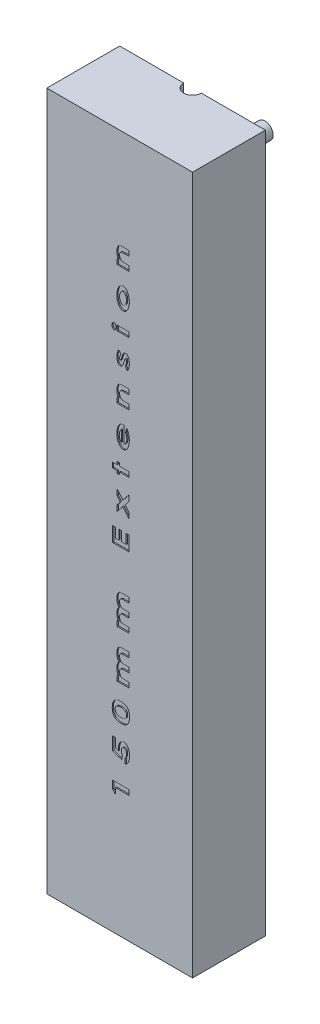
from build123d import *

# Parameters (mm, degrees)
SKETCH1_R            = 12.5
BOSS_EXTRUDE1_DEPTH  = 150.5
BOSS_EXTRUDE2_DEPTH  = 148.5
SKETCH8_R            = 12.5
CUT_EXTRUDE2_DEPTH   = 152.706130397
BOSS_EXTRUDE7_DEPTH  = 8
BOSS_EXTRUDE8_START  = -121
BOSS_EXTRUDE8_DEPTH  = 121
BOSS_EXTRUDE9_DEPTH  = 148.5
SKETCH13_R           = 1.75
CUT_EXTRUDE3_DEPTH   = 3.5
SKETCH14_R           = 1.75
BOSS_EXTRUDE10_DEPTH = 3.4
SKETCH15_R           = 1.75
CUT_EXTRUDE4_DEPTH   = 3.5
SKETCH16_R           = 1.75
BOSS_EXTRUDE11_DEPTH = 3.4
SKETCH18_W           = 2.557692308
SKETCH18_H           = 1.076923077
CUT_EXTRUDE6_DEPTH   = 0.25


with BuildPart() as part:
    # Sketch1 → Boss-Extrude1 (new body)
    with BuildSketch(Plane(origin=(0, 0, 0), x_dir=(1, 0, 0), z_dir=(0, 1, 0))):
        with Locations(Location((0, 0, 0), (0, 0, 270))):
            Circle(SKETCH1_R)
    extrude(amount=BOSS_EXTRUDE1_DEPTH)

    # Sketch2 → Boss-Extrude2 (add)
    with BuildSketch(Plane(origin=(0, 150.5, 0), x_dir=(1, 0, 0), z_dir=(0, 1, 0))):
        with BuildLine():
            Line((-13.5, 0), (13.5, 0))
            ThreePointArc((13.5, 0), (0, -13.5), (-13.5, 0))
        make_face()
    extrude(amount=-BOSS_EXTRUDE2_DEPTH)

    # Sketch8 → Cut-Extrude2 (cut, through all)
    with BuildSketch(Plane(origin=(0, 150.5, 0), x_dir=(1, 0, 0), z_dir=(0, 1, 0))):
        Circle(SKETCH8_R)
    extrude(amount=-CUT_EXTRUDE2_DEPTH, mode=Mode.SUBTRACT)

    # Sketch9 → Boss-Extrude7 (add)
    with BuildSketch(Plane(origin=(0, 150.5, 0), x_dir=(1, 0, 0), z_dir=(0, 1, 0))):
        with BuildLine():
            Line((12.5, 0), (1.875, 0))
            ThreePointArc((1.875, 0), (0, -1.875), (-1.875, 0))
            Line((-1.875, 0), (-12.5, 0))
            ThreePointArc((-12.5, 0), (0, -12.5), (12.5, 0))
        make_face()
    extrude(amount=-BOSS_EXTRUDE7_DEPTH)

    # Sketch11 → Boss-Extrude8 (add)
    with BuildSketch(Plane.XZ.offset(-2).offset(BOSS_EXTRUDE8_START)):
        with BuildLine():
            Line((-12.5, 0), (-8, 0))
            ThreePointArc((-8, 0), (0, 8), (8, 0))
            Line((8, 0), (12.5, 0))
            ThreePointArc((12.5, 0), (0, 12.5), (-12.5, 0))
        make_face()
    extrude(amount=BOSS_EXTRUDE8_DEPTH)

    # Sketch12 → Boss-Extrude9 (add)
    with BuildSketch(Plane(origin=(0, 150.5, 0), x_dir=(1, 0, 0), z_dir=(0, 1, 0))):
        with BuildLine():
            Line((-13.5, 0), (-15.5, 0))
            Line((-15.5, 0), (-15.5, -15.5))
            Line((-15.5, -15.5), (15.5, -15.5))
            Line((15.5, -15.5), (15.5, 0))
            Line((15.5, 0), (13.5, 0))
            ThreePointArc((13.5, 0), (0, -13.5), (-13.5, 0))
        make_face()
    extrude(amount=-BOSS_EXTRUDE9_DEPTH)

    # Sketch13 → Cut-Extrude3 (cut)
    with BuildSketch(Plane(origin=(0, 0, 0), x_dir=(-1, 0, 0), z_dir=(0, 0, -1))):
        with Locations((12, 147)):
            Circle(SKETCH13_R)
    extrude(amount=-CUT_EXTRUDE3_DEPTH, mode=Mode.SUBTRACT)

    # Sketch14 → Boss-Extrude10 (add)
    with BuildSketch(Plane(origin=(0, 0, 0), x_dir=(-1, 0, 0), z_dir=(0, 0, -1))):
        with Locations((-12, 147)):
            Circle(SKETCH14_R)
    extrude(amount=BOSS_EXTRUDE10_DEPTH)

    # Sketch15 → Cut-Extrude4 (cut)
    with BuildSketch(Plane(origin=(0, 0, 0), x_dir=(-1, 0, 0), z_dir=(0, 0, -1))):
        with Locations((-12, 5.5)):
            Circle(SKETCH15_R)
    extrude(amount=-CUT_EXTRUDE4_DEPTH, mode=Mode.SUBTRACT)

    # Sketch16 → Boss-Extrude11 (add)
    with BuildSketch(Plane(origin=(0, 0, 0), x_dir=(-1, 0, 0), z_dir=(0, 0, -1))):
        with Locations((12, 5.5)):
            Circle(SKETCH16_R)
    extrude(amount=BOSS_EXTRUDE11_DEPTH)

    # Sketch18 → Cut-Extrude6 (cut)
    # profile 1 of 15: a face of its own
    with BuildSketch(Plane.XY.offset(15.5)):
        Polygon((-1.5, 28.311097756), (-1.5, 29.961538462), (2, 29.961538462), (2, 28.884615385), (-0.916666667, 28.884615385), (-0.916666667, 27.673076923), align=None)
    # profile 2 of 15: a face of its own
    with BuildSketch(Plane.XY.offset(15.5)):
        with BuildLine():
            Line((-1.5, 35.391726763), (-1.5, 38.128205128))
            Line((-1.5, 38.128205128), (-0.916666667, 38.128205128))
            Line((-0.916666667, 38.128205128), (-0.916666667, 36.214142628))
            Line((-0.916666667, 36.214142628), (-0.254807692, 35.975060096))
            add(Edge.make_bspline(
                [(-0.254807692, 35.975060096), (-0.259988923, 36.007507661), (-0.270176439, 36.071307195), (-0.280551947, 36.166292562), (-0.287159319, 36.25821841), (-0.288034547, 36.318599273), (-0.288461538, 36.348056891)],
                knots=[0, 0, 0, 0, 1.051536562, 2.067567929, 3.057236978, 4, 4, 4, 4], degree=3))
            add(Edge.make_bspline(
                [(-0.288461538, 36.348056891), (-0.287628341, 36.412126937), (-0.285995892, 36.537656591), (-0.270002992, 36.721648009), (-0.245179891, 36.897583066), (-0.209710122, 37.06520123), (-0.163136425, 37.224433976), (-0.106976739, 37.375589484), (-0.041504138, 37.519053835), (0.034844766, 37.652181041), (0.117829482, 37.774010883), (0.208297834, 37.880323614), (0.304528331, 37.97070793), (0.406395394, 38.045161218), (0.51486959, 38.102546972), (0.628757484, 38.143746307), (0.748641691, 38.16805188), (0.830419369, 38.171385959), (0.871895032, 38.173076923)],
                knots=[0, 0, 0, 0, 1.285126278, 2.517892021, 3.702160817, 4.847992253, 5.95190268, 7.027499764, 8.080655882, 9.111767517, 10.10280642, 11.033985104, 11.906450985, 12.745848305, 13.557550898, 14.359923657, 15.168192882, 16, 16, 16, 16], degree=3))
            add(Edge.make_bspline(
                [(0.871895032, 38.173076923), (0.913859014, 38.171268779), (0.997238157, 38.167676138), (1.11977112, 38.140483598), (1.236597108, 38.093932522), (1.348228978, 38.03022381), (1.454546489, 37.948118847), (1.55531246, 37.847941912), (1.650978481, 37.729673312), (1.739996246, 37.595196589), (1.822169011, 37.448643207), (1.893711511, 37.292104711), (1.954879936, 37.128212618), (2.003798241, 36.955989434), (2.042165462, 36.776313293), (2.070412639, 36.588820716), (2.086411006, 36.393443884), (2.08861956, 36.260678866), (2.08974359, 36.193108974)],
                knots=[0, 0, 0, 0, 0.78802525, 1.565744404, 2.344417368, 3.142820932, 3.972730725, 4.860717351, 5.806374154, 6.825666734, 7.887162955, 8.959887664, 10.056052622, 11.170627005, 12.320323857, 13.505753456, 14.730569455, 16, 16, 16, 16], degree=3))
            add(Edge.make_bspline(
                [(2.08974359, 36.193108974), (2.08880553, 36.132567093), (2.086960399, 36.013483251), (2.076282175, 35.837874379), (2.055360568, 35.66907225), (2.028604614, 35.506234602), (1.992577042, 35.350497514), (1.950239072, 35.200517404), (1.897951782, 35.058015388), (1.839719876, 34.922081471), (1.774015187, 34.79559537), (1.702663224, 34.679145534), (1.624801508, 34.574650855), (1.541456228, 34.480832519), (1.452123238, 34.398769423), (1.35613166, 34.328824024), (1.255371563, 34.268835815), (1.183371336, 34.239166821), (1.147435897, 34.224358974)],
                knots=[0, 0, 0, 0, 1.25655317, 2.471597798, 3.648941709, 4.785206545, 5.894738896, 6.964712259, 8.017251193, 9.042618574, 10.031844767, 10.972706793, 11.873888934, 12.732644413, 13.573754768, 14.385734448, 15.194317255, 16, 16, 16, 16], degree=3))
            Line((1.147435897, 34.224358974), (1.147435897, 35.391025641))
            add(Edge.make_bspline(
                [(1.147435897, 35.391025641), (1.172455313, 35.414431965), (1.222705783, 35.461442606), (1.286069954, 35.54529255), (1.340146471, 35.638805434), (1.383870261, 35.742455062), (1.418771308, 35.853754398), (1.443871827, 35.971569802), (1.458825264, 36.095032096), (1.460622596, 36.179044706), (1.461538462, 36.221854968)],
                knots=[0, 0, 0, 0, 0.896977403, 1.801542313, 2.743307529, 3.723371397, 4.744769447, 5.797650386, 6.877749863, 8, 8, 8, 8], degree=3))
            add(Edge.make_bspline(
                [(1.461538462, 36.221854968), (1.460894158, 36.251780146), (1.459633994, 36.31030945), (1.452850282, 36.396551104), (1.440110656, 36.479193287), (1.422677594, 36.558629524), (1.400235046, 36.634565624), (1.372880352, 36.707012967), (1.340537075, 36.775934761), (1.303744891, 36.840801968), (1.262867246, 36.900117873), (1.218537302, 36.952074226), (1.172310553, 36.997275431), (1.121918766, 37.033082672), (1.06911192, 37.061757035), (1.012958847, 37.081285297), (0.954234659, 37.093698497), (0.914025038, 37.095327552), (0.893629808, 37.096153846)],
                knots=[0, 0, 0, 0, 1.246571979, 2.438113878, 3.600023611, 4.726573901, 5.823031953, 6.895108602, 7.948911145, 8.990868262, 9.998052814, 10.944064317, 11.832216848, 12.683156875, 13.510554676, 14.326420236, 15.151122455, 16, 16, 16, 16], degree=3))
            add(Edge.make_bspline(
                [(0.893629808, 37.096153846), (0.87370782, 37.095573147), (0.834697398, 37.094436045), (0.777570008, 37.082671228), (0.723436998, 37.063605141), (0.671597236, 37.03751713), (0.623087343, 37.003378845), (0.577117743, 36.962093378), (0.53345559, 36.913730146), (0.494324211, 36.857579015), (0.458068809, 36.797210875), (0.42632299, 36.733003537), (0.399568747, 36.665469204), (0.378254924, 36.59450884), (0.360170472, 36.520918723), (0.348914867, 36.443901941), (0.340497558, 36.364135358), (0.339997428, 36.309752896), (0.33974359, 36.282151442)],
                knots=[0, 0, 0, 0, 0.876153622, 1.715648235, 2.555268965, 3.397408059, 4.262310933, 5.158714413, 6.113238066, 7.124008222, 8.166949607, 9.211564772, 10.273969169, 11.361101136, 12.471743462, 13.606902068, 14.785399164, 16, 16, 16, 16], degree=3))
            add(Edge.make_bspline(
                [(0.33974359, 36.282151442), (0.340408317, 36.252204017), (0.341741811, 36.192127214), (0.352859403, 36.102659143), (0.369393197, 36.013452585), (0.394098811, 35.925358361), (0.426035764, 35.837838671), (0.464477566, 35.751066401), (0.510176943, 35.665060386), (0.54548698, 35.609778104), (0.563401442, 35.581730769)],
                knots=[0, 0, 0, 0, 0.962989015, 1.931828919, 2.896078871, 3.879163779, 4.870834245, 5.890601325, 6.929801607, 8, 8, 8, 8], degree=3))
            Line((0.563401442, 35.581730769), (0.442107372, 34.684995994))
            Line((0.442107372, 34.684995994), (-1.5, 35.391726763))
        make_face()
    # profile 3 of 15: a face of its own
    with BuildSketch(Plane.XY.offset(15.5)):
        with BuildLine():
            add(Edge.make_bspline(
                [(-1.58974359, 43.315805288), (-1.589293826, 43.36746958), (-1.588411874, 43.468779149), (-1.578854729, 43.618000446), (-1.564241333, 43.761849542), (-1.544364743, 43.900480474), (-1.517389179, 44.033531721), (-1.485322223, 44.161116185), (-1.447615042, 44.283453263), (-1.403466032, 44.400130996), (-1.352872335, 44.510773485), (-1.29725042, 44.615894433), (-1.233543204, 44.713312149), (-1.16485813, 44.805030734), (-1.089547652, 44.890095442), (-1.008228867, 44.968658733), (-0.920626453, 45.040748038), (-0.826335398, 45.106270558), (-0.724060924, 45.164945377), (-0.612533529, 45.215522045), (-0.491621845, 45.257963332), (-0.361398036, 45.293281937), (-0.221318141, 45.31916846), (-0.072064366, 45.339070811), (0.086713197, 45.349891068), (0.195531413, 45.351657275), (0.251402244, 45.352564103)],
                knots=[0, 0, 0, 0, 1.180076718, 2.314036622, 3.414226188, 4.482594488, 5.511827987, 6.514051976, 7.486717573, 8.434643478, 9.361635716, 10.264531142, 11.148604878, 12.017770531, 12.880121158, 13.74098312, 14.598195235, 15.469015398, 16.361001076, 17.287993313, 18.262313192, 19.285435953, 20.367061594, 21.514017738, 22.723615396, 24, 24, 24, 24], degree=3))
            add(Edge.make_bspline(
                [(0.251402244, 45.352564103), (0.307971012, 45.351637403), (0.417950632, 45.349835737), (0.578203527, 45.339340575), (0.728550996, 45.318319772), (0.869654662, 45.292089357), (1.000566373, 45.255575536), (1.122704353, 45.213778851), (1.234238476, 45.16137848), (1.336978644, 45.102204258), (1.430771955, 45.035519159), (1.519022146, 44.965039346), (1.599810032, 44.887820154), (1.67516992, 44.806098683), (1.743229539, 44.717873463), (1.80508684, 44.62473101), (1.859758291, 44.525743327), (1.909268698, 44.421756226), (1.951839873, 44.310989009), (1.989280107, 44.193797291), (2.0193732, 44.06942888), (2.046016224, 43.938605732), (2.064735151, 43.800584764), (2.079983716, 43.655670114), (2.088123325, 43.503800239), (2.089196479, 43.400181978), (2.08974359, 43.347355769)],
                knots=[0, 0, 0, 0, 1.303007808, 2.533275996, 3.695697172, 4.797792616, 5.835923634, 6.823318227, 7.767314319, 8.669310076, 9.550360526, 10.415381791, 11.268259909, 12.121681392, 12.973335674, 13.831750096, 14.694389994, 15.575637731, 16.482263123, 17.425353364, 18.407083164, 19.427877478, 20.498921731, 21.613499575, 22.783324783, 24, 24, 24, 24], degree=3))
            add(Edge.make_bspline(
                [(2.08974359, 43.347355769), (2.089208034, 43.294294895), (2.088159813, 43.190441018), (2.079858338, 43.037653191), (2.064835545, 42.891544284), (2.045784792, 42.751485518), (2.019679327, 42.618390168), (1.988342198, 42.491393127), (1.950313075, 42.371255568), (1.907895673, 42.256874928), (1.858382219, 42.149374679), (1.803916203, 42.047541325), (1.743319759, 41.951642149), (1.676777995, 41.861661957), (1.60362183, 41.778192336), (1.524703545, 41.700535203), (1.439586118, 41.629173859), (1.348902059, 41.562549939), (1.249998521, 41.502606841), (1.140583145, 41.453006312), (1.022312578, 41.408819104), (0.893528502, 41.374424462), (0.755088393, 41.347201112), (0.606875889, 41.327637282), (0.448815755, 41.316741634), (0.340227447, 41.314999139), (0.284354968, 41.314102564)],
                knots=[0, 0, 0, 0, 1.22301636, 2.393759872, 3.525291218, 4.607843895, 5.650581523, 6.650065805, 7.621203195, 8.553697386, 9.460058488, 10.347001555, 11.213807325, 12.072490159, 12.923842102, 13.769499777, 14.622009836, 15.481840914, 16.361342211, 17.281998107, 18.246659576, 19.268596013, 20.350411278, 21.497011607, 22.712125016, 24, 24, 24, 24], degree=3))
            add(Edge.make_bspline(
                [(0.284354968, 41.314102564), (0.244852915, 41.314560665), (0.167211397, 41.315461065), (0.052827315, 41.320941484), (-0.057302757, 41.33085487), (-0.163463094, 41.344227223), (-0.265580517, 41.360594741), (-0.36327456, 41.381924094), (-0.456960933, 41.40633222), (-0.54669233, 41.434902157), (-0.631895454, 41.468008056), (-0.713325429, 41.503787582), (-0.790495537, 41.543630115), (-0.863344971, 41.58799416), (-0.932543825, 41.635549906), (-0.996893196, 41.687940122), (-1.058278563, 41.742698018), (-1.095294215, 41.782842514), (-1.113681891, 41.802784455)],
                knots=[0, 0, 0, 0, 1.242259397, 2.441668153, 3.600116491, 4.718640213, 5.806066657, 6.851168191, 7.86193009, 8.849746311, 9.810620033, 10.735196321, 11.645732514, 12.539383286, 13.416039062, 14.283776944, 15.147459225, 16, 16, 16, 16], degree=3))
            add(Edge.make_bspline(
                [(-1.113681891, 41.802784455), (-1.151994173, 41.849388176), (-1.229270931, 41.943388958), (-1.325034168, 42.101320517), (-1.407972107, 42.270981312), (-1.473975102, 42.454632131), (-1.52698937, 42.651015883), (-1.563448991, 42.861054129), (-1.58525827, 43.084205115), (-1.588221824, 43.237228707), (-1.58974359, 43.315805288)],
                knots=[0, 0, 0, 0, 0.892209385, 1.799606942, 2.72656502, 3.684362885, 4.684002414, 5.734699752, 6.836783623, 8, 8, 8, 8], degree=3))
        make_face()
        with BuildLine():
            add(Edge.make_bspline(
                [(-0.961538462, 43.341045673), (-0.960207832, 43.295394624), (-0.957607804, 43.206193211), (-0.936831601, 43.076332336), (-0.903173791, 42.954210306), (-0.86417753, 42.858274793), (-0.825094331, 42.786720876), (-0.790529102, 42.736701785), (-0.750879364, 42.690157449), (-0.706446272, 42.646643973), (-0.657598869, 42.605716514), (-0.603005956, 42.569591107), (-0.544400977, 42.535566173), (-0.480478555, 42.504335174), (-0.409552566, 42.478157492), (-0.332092021, 42.453726808), (-0.246595804, 42.434832146), (-0.153728673, 42.418611079), (-0.053332636, 42.406253636), (0.054702129, 42.397009036), (0.170502532, 42.392546531), (0.250231013, 42.391543266), (0.291366186, 42.391025641)],
                knots=[0, 0, 0, 0, 1.509914973, 2.95034952, 4.338696212, 5.694353907, 6.365834149, 7.032936389, 7.702275881, 8.385804146, 9.088783742, 9.807286494, 10.548726808, 11.330371283, 12.157620739, 13.047956491, 14.015909663, 15.052044035, 16.166587927, 17.361704279, 18.638795689, 20, 20, 20, 20], degree=3))
            add(Edge.make_bspline(
                [(0.291366186, 42.391025641), (0.34468141, 42.391739709), (0.447032865, 42.393110535), (0.594066237, 42.406051892), (0.728456982, 42.425729332), (0.850139253, 42.454080426), (0.959089625, 42.49107501), (1.055338283, 42.536588951), (1.138992242, 42.5904331), (1.209426434, 42.653513736), (1.269016535, 42.722761128), (1.320318463, 42.796777847), (1.364351754, 42.875276836), (1.400179576, 42.958906159), (1.427412779, 43.047838101), (1.446855976, 43.141250925), (1.459144741, 43.239526112), (1.460727534, 43.306653613), (1.461538462, 43.341045673)],
                knots=[0, 0, 0, 0, 1.480441952, 2.842066029, 4.09604041, 5.250074021, 6.307217429, 7.285625283, 8.200200189, 9.059971394, 9.902016517, 10.732093184, 11.557359395, 12.397726661, 13.253863907, 14.136079897, 15.045040387, 16, 16, 16, 16], degree=3))
            add(Edge.make_bspline(
                [(1.461538462, 43.341045673), (1.460948245, 43.37403201), (1.459793482, 43.438569912), (1.448358145, 43.532669022), (1.429703961, 43.621494396), (1.402709804, 43.704720887), (1.36913397, 43.783157199), (1.327641531, 43.856357611), (1.278343627, 43.924266604), (1.240196167, 43.964957713), (1.221053686, 43.985376603)],
                knots=[0, 0, 0, 0, 1.119913555, 2.191115426, 3.213965407, 4.19797918, 5.157911113, 6.10701764, 7.050097187, 8, 8, 8, 8], degree=3))
            add(Edge.make_bspline(
                [(1.221053686, 43.985376603), (1.195497933, 44.008821842), (1.14339072, 44.0566258), (1.051225366, 44.115360414), (0.947400068, 44.164855756), (0.831739553, 44.20652782), (0.703540882, 44.237451352), (0.563534682, 44.259295335), (0.4115642, 44.273882102), (0.306126273, 44.275040038), (0.251402244, 44.275641026)],
                knots=[0, 0, 0, 0, 0.801067527, 1.633346405, 2.51596037, 3.458272169, 4.471900348, 5.561630268, 6.734445755, 8, 8, 8, 8], degree=3))
            add(Edge.make_bspline(
                [(0.251402244, 44.275641026), (0.196225853, 44.274826406), (0.089943219, 44.273257258), (-0.062766005, 44.261578266), (-0.202272138, 44.241694885), (-0.328203663, 44.213063975), (-0.441235248, 44.177112438), (-0.541032934, 44.132354842), (-0.627533556, 44.079018015), (-0.700692487, 44.017236478), (-0.76180354, 43.948618943), (-0.815667747, 43.876414798), (-0.860597609, 43.798588471), (-0.897904587, 43.716467184), (-0.926961051, 43.629320872), (-0.946976485, 43.5374118), (-0.959083365, 43.440694192), (-0.960708435, 43.374735133), (-0.961538462, 43.341045673)],
                knots=[0, 0, 0, 0, 1.511250614, 2.9110222, 4.192049323, 5.367598599, 6.444579704, 7.435826047, 8.355956352, 9.219048619, 10.048411987, 10.867833571, 11.682515457, 12.504757777, 13.334738552, 14.193642413, 15.077379005, 16, 16, 16, 16], degree=3))
        make_face(mode=Mode.SUBTRACT)
    # profile 4 of 15: a face of its own
    with BuildSketch(Plane.XY.offset(15.5)):
        with BuildLine():
            Line((-0.557692308, 48.673076923), (-0.557692308, 49.75))
            Line((-0.557692308, 49.75), (-0.252003205, 49.75))
            add(Edge.make_bspline(
                [(-0.252003205, 49.75), (-0.280414051, 49.797456372), (-0.337516438, 49.89283798), (-0.408518832, 50.045226005), (-0.469046866, 50.204793799), (-0.518114828, 50.372189268), (-0.555692671, 50.547306103), (-0.583053445, 50.729928126), (-0.599285492, 50.92034449), (-0.601457981, 51.049848408), (-0.602564103, 51.115785256)],
                knots=[0, 0, 0, 0, 0.928492069, 1.866157527, 2.819023524, 3.792835013, 4.792976067, 5.824993516, 6.892596658, 8, 8, 8, 8], degree=3))
            add(Edge.make_bspline(
                [(-0.602564103, 51.115785256), (-0.601423985, 51.181998802), (-0.599189194, 51.311786733), (-0.575675276, 51.500893728), (-0.54076559, 51.680658023), (-0.497678997, 51.822508894), (-0.456290913, 51.930205298), (-0.422126893, 52.006283218), (-0.384754666, 52.078436639), (-0.343950363, 52.146515268), (-0.300249557, 52.21111751), (-0.251885155, 52.270643673), (-0.201837505, 52.327348457), (-0.165121478, 52.361497542), (-0.146834936, 52.378505609)],
                knots=[0, 0, 0, 0, 1.724585084, 3.380431133, 4.958200409, 6.491779235, 7.235973326, 7.963789565, 8.663837766, 9.35213129, 10.031202305, 10.694132921, 11.349608478, 12, 12, 12, 12], degree=3))
            add(Edge.make_bspline(
                [(-0.146834936, 52.378505609), (-0.182661368, 52.423590103), (-0.255247717, 52.514933803), (-0.347173879, 52.66794088), (-0.42452029, 52.835727939), (-0.489681214, 53.016776051), (-0.540638794, 53.209619352), (-0.575390596, 53.412393474), (-0.599202386, 53.623366751), (-0.601429695, 53.767125642), (-0.602564103, 53.840344551)],
                knots=[0, 0, 0, 0, 0.883833791, 1.790696565, 2.733427488, 3.717936822, 4.7427991, 5.792754128, 6.875811196, 8, 8, 8, 8], degree=3))
            add(Edge.make_bspline(
                [(-0.602564103, 53.840344551), (-0.602106565, 53.878444887), (-0.601205032, 53.953517886), (-0.595689803, 54.064160394), (-0.58591376, 54.171301356), (-0.57173388, 54.274862724), (-0.554525477, 54.375318091), (-0.532670842, 54.471874352), (-0.507439968, 54.565064397), (-0.478257549, 54.654260151), (-0.445379154, 54.738599605), (-0.41045579, 54.817314377), (-0.373156531, 54.889959325), (-0.333741083, 54.956704438), (-0.290321933, 55.016203664), (-0.24649479, 55.07086937), (-0.199298612, 55.118814467), (-0.148610348, 55.160869044), (-0.093131899, 55.198630695), (-0.029303575, 55.228581821), (0.041480749, 55.255898996), (0.120547884, 55.276887294), (0.207433497, 55.293890765), (0.302124039, 55.305146918), (0.404568449, 55.313426184), (0.475508653, 55.313871907), (0.512219551, 55.314102564)],
                knots=[0, 0, 0, 0, 1.289078282, 2.540003121, 3.746972087, 4.927862295, 6.075729455, 7.194104379, 8.275964383, 9.341167745, 10.367571177, 11.337410537, 12.253340016, 13.12935433, 13.956621643, 14.743290337, 15.498119774, 16.228062707, 16.969310079, 17.761443742, 18.607320452, 19.533837494, 20.524754116, 21.600645111, 22.758356077, 24, 24, 24, 24], degree=3))
            Line((0.512219551, 55.314102564), (2, 55.314102564))
            Line((2, 55.314102564), (2, 54.237179487))
            Line((2, 54.237179487), (0.715544872, 54.237179487))
            add(Edge.make_bspline(
                [(0.715544872, 54.237179487), (0.681166117, 54.236753591), (0.615080727, 54.235934901), (0.520433575, 54.226645259), (0.434326891, 54.212251025), (0.356831503, 54.192006091), (0.287481228, 54.166613101), (0.227259618, 54.133966405), (0.175017271, 54.0960371), (0.131747567, 54.050987927), (0.095853522, 54.00018835), (0.064603678, 53.944318137), (0.039159562, 53.882203144), (0.017013721, 53.814881553), (0.001386614, 53.741227734), (-0.010309818, 53.662082419), (-0.018509058, 53.577125235), (-0.018985423, 53.518549988), (-0.019230769, 53.48838141)],
                knots=[0, 0, 0, 0, 1.347860215, 2.59095684, 3.725620218, 4.76829943, 5.728428206, 6.614284922, 7.446550871, 8.250317491, 9.05157168, 9.880398499, 10.7553772, 11.68002573, 12.656293712, 13.703675767, 14.817301856, 16, 16, 16, 16], degree=3))
            add(Edge.make_bspline(
                [(-0.019230769, 53.48838141), (-0.018283865, 53.442044996), (-0.016435443, 53.35159306), (0.001784414, 53.219705058), (0.030125551, 53.094843107), (0.070369031, 52.978340063), (0.121020233, 52.872801901), (0.18059697, 52.78016823), (0.250220316, 52.702587027), (0.31624125, 52.649060002), (0.37532847, 52.613750988), (0.426414908, 52.5927118), (0.482924005, 52.573304543), (0.545905333, 52.558417015), (0.615196636, 52.546339424), (0.690641361, 52.538548265), (0.772234733, 52.532353024), (0.828645507, 52.532154263), (0.857872596, 52.532051282)],
                knots=[0, 0, 0, 0, 1.484949937, 2.898726635, 4.260218916, 5.584982182, 6.841814349, 8.005742258, 9.104141186, 10.170293199, 10.717790152, 11.305216422, 11.937929379, 12.632213569, 13.377556996, 14.191849794, 15.063175981, 16, 16, 16, 16], degree=3))
            Line((0.857872596, 52.532051282), (2, 52.532051282))
            Line((2, 52.532051282), (2, 51.455128205))
            Line((2, 51.455128205), (0.773737981, 51.455128205))
            add(Edge.make_bspline(
                [(0.773737981, 51.455128205), (0.746384744, 51.454915808), (0.693747125, 51.454507079), (0.617559634, 51.44980541), (0.54721578, 51.444443004), (0.48280511, 51.433869616), (0.423940037, 51.422915012), (0.371225403, 51.406970687), (0.323800755, 51.389894401), (0.269171805, 51.362854775), (0.208587339, 51.322109306), (0.146952657, 51.261160464), (0.094239772, 51.190201255), (0.052611798, 51.10818833), (0.020315575, 51.016658696), (-0.002290318, 50.916161121), (-0.016581775, 50.806530036), (-0.018324812, 50.730449133), (-0.019230769, 50.690905449)],
                knots=[0, 0, 0, 0, 1.023830866, 1.970224575, 2.857416773, 3.662980691, 4.412831413, 5.096686335, 5.722376424, 6.297579626, 7.375037059, 8.439233302, 9.527682778, 10.670344048, 11.868630374, 13.152679384, 14.520081351, 16, 16, 16, 16], degree=3))
            add(Edge.make_bspline(
                [(-0.019230769, 50.690905449), (-0.018371692, 50.646188486), (-0.01669088, 50.5586983), (0.002911152, 50.430956256), (0.030662263, 50.308878708), (0.072048697, 50.194691443), (0.123063254, 50.090084765), (0.185116569, 49.998613583), (0.256602942, 49.921201721), (0.324331881, 49.867377561), (0.385213811, 49.832766887), (0.437104769, 49.810128948), (0.495217447, 49.791622383), (0.559203544, 49.776291512), (0.629231334, 49.76431574), (0.705363619, 49.756491744), (0.787661017, 49.75030468), (0.844537972, 49.750103964), (0.873998397, 49.75)],
                knots=[0, 0, 0, 0, 1.435559163, 2.808717964, 4.14383507, 5.452653956, 6.701953608, 7.874603836, 8.990506502, 10.076573984, 10.638227321, 11.236771952, 11.892203885, 12.595248802, 13.349563718, 14.173037269, 15.053692327, 16, 16, 16, 16], degree=3))
            Line((0.873998397, 49.75), (2, 49.75))
            Line((2, 49.75), (2, 48.673076923))
            Line((2, 48.673076923), (-0.557692308, 48.673076923))
        make_face()
    # profile 5 of 15: a face of its own
    with BuildSketch(Plane.XY.offset(15.5)):
        with BuildLine():
            Line((-0.557692308, 58.769230769), (-0.557692308, 59.846153846))
            Line((-0.557692308, 59.846153846), (-0.252003205, 59.846153846))
            add(Edge.make_bspline(
                [(-0.252003205, 59.846153846), (-0.280414051, 59.893610219), (-0.337516438, 59.988991827), (-0.408518832, 60.141379851), (-0.469046866, 60.300947645), (-0.518114828, 60.468343114), (-0.555692671, 60.643459949), (-0.583053445, 60.826081972), (-0.599285492, 61.016498336), (-0.601457981, 61.146002255), (-0.602564103, 61.211939103)],
                knots=[0, 0, 0, 0, 0.928492069, 1.866157527, 2.819023524, 3.792835013, 4.792976067, 5.824993516, 6.892596658, 8, 8, 8, 8], degree=3))
            add(Edge.make_bspline(
                [(-0.602564103, 61.211939103), (-0.601423985, 61.278152648), (-0.599189194, 61.40794058), (-0.575675276, 61.597047574), (-0.54076559, 61.776811869), (-0.497678997, 61.91866274), (-0.456290913, 62.026359145), (-0.422126893, 62.102437064), (-0.384754666, 62.174590485), (-0.343950363, 62.242669114), (-0.300249557, 62.307271356), (-0.251885155, 62.366797519), (-0.201837505, 62.423502303), (-0.165121478, 62.457651388), (-0.146834936, 62.474659455)],
                knots=[0, 0, 0, 0, 1.724585084, 3.380431133, 4.958200409, 6.491779235, 7.235973326, 7.963789565, 8.663837766, 9.35213129, 10.031202305, 10.694132921, 11.349608478, 12, 12, 12, 12], degree=3))
            add(Edge.make_bspline(
                [(-0.146834936, 62.474659455), (-0.182661368, 62.519743949), (-0.255247717, 62.61108765), (-0.347173879, 62.764094726), (-0.42452029, 62.931881786), (-0.489681214, 63.112929897), (-0.540638794, 63.305773198), (-0.575390596, 63.508547321), (-0.599202386, 63.719520597), (-0.601429695, 63.863279488), (-0.602564103, 63.936498397)],
                knots=[0, 0, 0, 0, 0.883833791, 1.790696565, 2.733427488, 3.717936822, 4.7427991, 5.792754128, 6.875811196, 8, 8, 8, 8], degree=3))
            add(Edge.make_bspline(
                [(-0.602564103, 63.936498397), (-0.602106565, 63.974598733), (-0.601205032, 64.049671732), (-0.595689803, 64.16031424), (-0.58591376, 64.267455202), (-0.57173388, 64.37101657), (-0.554525477, 64.471471937), (-0.532670842, 64.568028198), (-0.507439968, 64.661218243), (-0.478257549, 64.750413997), (-0.445379154, 64.834753451), (-0.41045579, 64.913468223), (-0.373156531, 64.986113171), (-0.333741083, 65.052858284), (-0.290321933, 65.112357511), (-0.24649479, 65.167023216), (-0.199298612, 65.214968313), (-0.148610348, 65.25702289), (-0.093131899, 65.294784541), (-0.029303575, 65.324735667), (0.041480749, 65.352052842), (0.120547884, 65.373041141), (0.207433497, 65.390044611), (0.302124039, 65.401300764), (0.404568449, 65.40958003), (0.475508653, 65.410025753), (0.512219551, 65.41025641)],
                knots=[0, 0, 0, 0, 1.289078282, 2.540003121, 3.746972087, 4.927862295, 6.075729455, 7.194104379, 8.275964383, 9.341167745, 10.367571177, 11.337410537, 12.253340016, 13.12935433, 13.956621643, 14.743290337, 15.498119774, 16.228062707, 16.969310079, 17.761443742, 18.607320452, 19.533837494, 20.524754116, 21.600645111, 22.758356077, 24, 24, 24, 24], degree=3))
            Line((0.512219551, 65.41025641), (2, 65.41025641))
            Line((2, 65.41025641), (2, 64.333333333))
            Line((2, 64.333333333), (0.715544872, 64.333333333))
            add(Edge.make_bspline(
                [(0.715544872, 64.333333333), (0.681166117, 64.332907437), (0.615080727, 64.332088747), (0.520433575, 64.322799105), (0.434326891, 64.308404871), (0.356831503, 64.288159937), (0.287481228, 64.262766947), (0.227259618, 64.230120251), (0.175017271, 64.192190946), (0.131747567, 64.147141773), (0.095853522, 64.096342196), (0.064603678, 64.040471983), (0.039159562, 63.97835699), (0.017013721, 63.911035399), (0.001386614, 63.83738158), (-0.010309818, 63.758236266), (-0.018509058, 63.673279081), (-0.018985423, 63.614703834), (-0.019230769, 63.584535256)],
                knots=[0, 0, 0, 0, 1.347860215, 2.59095684, 3.725620218, 4.76829943, 5.728428206, 6.614284922, 7.446550871, 8.250317491, 9.05157168, 9.880398499, 10.7553772, 11.68002573, 12.656293712, 13.703675767, 14.817301856, 16, 16, 16, 16], degree=3))
            add(Edge.make_bspline(
                [(-0.019230769, 63.584535256), (-0.018283865, 63.538198843), (-0.016435443, 63.447746907), (0.001784414, 63.315858904), (0.030125551, 63.190996953), (0.070369031, 63.074493909), (0.121020233, 62.968955747), (0.18059697, 62.876322076), (0.250220316, 62.798740873), (0.31624125, 62.745213848), (0.37532847, 62.709904834), (0.426414908, 62.688865647), (0.482924005, 62.669458389), (0.545905333, 62.654570861), (0.615196636, 62.64249327), (0.690641361, 62.634702112), (0.772234733, 62.62850687), (0.828645507, 62.628308109), (0.857872596, 62.628205128)],
                knots=[0, 0, 0, 0, 1.484949937, 2.898726635, 4.260218916, 5.584982182, 6.841814349, 8.005742258, 9.104141186, 10.170293199, 10.717790152, 11.305216422, 11.937929379, 12.632213569, 13.377556996, 14.191849794, 15.063175981, 16, 16, 16, 16], degree=3))
            Line((0.857872596, 62.628205128), (2, 62.628205128))
            Line((2, 62.628205128), (2, 61.551282051))
            Line((2, 61.551282051), (0.773737981, 61.551282051))
            add(Edge.make_bspline(
                [(0.773737981, 61.551282051), (0.746384744, 61.551069654), (0.693747125, 61.550660925), (0.617559634, 61.545959256), (0.54721578, 61.540596851), (0.48280511, 61.530023462), (0.423940037, 61.519068858), (0.371225403, 61.503124533), (0.323800755, 61.486048247), (0.269171805, 61.459008621), (0.208587339, 61.418263152), (0.146952657, 61.35731431), (0.094239772, 61.286355102), (0.052611798, 61.204342177), (0.020315575, 61.112812542), (-0.002290318, 61.012314967), (-0.016581775, 60.902683882), (-0.018324812, 60.826602979), (-0.019230769, 60.787059295)],
                knots=[0, 0, 0, 0, 1.023830866, 1.970224575, 2.857416773, 3.662980691, 4.412831413, 5.096686335, 5.722376424, 6.297579626, 7.375037059, 8.439233302, 9.527682778, 10.670344048, 11.868630374, 13.152679384, 14.520081351, 16, 16, 16, 16], degree=3))
            add(Edge.make_bspline(
                [(-0.019230769, 60.787059295), (-0.018371692, 60.742342332), (-0.01669088, 60.654852147), (0.002911152, 60.527110102), (0.030662263, 60.405032554), (0.072048697, 60.290845289), (0.123063254, 60.186238612), (0.185116569, 60.094767429), (0.256602942, 60.017355567), (0.324331881, 59.963531408), (0.385213811, 59.928920733), (0.437104769, 59.906282794), (0.495217447, 59.887776229), (0.559203544, 59.872445358), (0.629231334, 59.860469586), (0.705363619, 59.85264559), (0.787661017, 59.846458526), (0.844537972, 59.84625781), (0.873998397, 59.846153846)],
                knots=[0, 0, 0, 0, 1.435559163, 2.808717964, 4.14383507, 5.452653956, 6.701953608, 7.874603836, 8.990506502, 10.076573984, 10.638227321, 11.236771952, 11.892203885, 12.595248802, 13.349563718, 14.173037269, 15.053692327, 16, 16, 16, 16], degree=3))
            Line((0.873998397, 59.846153846), (2, 59.846153846))
            Line((2, 59.846153846), (2, 58.769230769))
            Line((2, 58.769230769), (-0.557692308, 58.769230769))
        make_face()
    # profile 6 of 15: a face of its own
    with BuildSketch(Plane.XY.offset(15.5)):
        Polygon((-1.5, 73.756410256), (-1.5, 76.897435897), (-0.871794872, 76.897435897), (-0.871794872, 74.833333333), (-0.198717949, 74.833333333), (-0.198717949, 76.897435897), (0.429487179, 76.897435897), (0.429487179, 74.833333333), (1.371794872, 74.833333333), (1.371794872, 76.897435897), (2, 76.897435897), (2, 73.756410256), align=None)
    # profile 7 of 15: a face of its own
    with BuildSketch(Plane.XY.offset(15.5)):
        Polygon((-0.557692308, 79.956430288), (-0.557692308, 81.178485577), (0.139923878, 82.029647436), (-0.557692308, 82.876602564), (-0.557692308, 84.097255609), (0.64052484, 82.641025641), (2, 84.301282051), (2, 83.079226763), (1.141826923, 82.031750801), (2, 80.988481571), (2, 79.769230769), (0.641225962, 81.420372596), align=None)
    # profile 8 of 15: a face of its own
    with BuildSketch(Plane.XY.offset(15.5)):
        Polygon((-1.544871795, 87.487179487), (-1.544871795, 88.564102564), (-0.557692308, 88.564102564), (-0.557692308, 89.192307692), (-0.019230769, 89.192307692), (-0.019230769, 88.564102564), (2, 88.564102564), (2, 87.487179487), (-0.019230769, 87.487179487), (-0.019230769, 86.948717949), (-0.557692308, 86.948717949), (-0.557692308, 87.487179487), align=None)
    # profile 9 of 15: a face of its own
    with BuildSketch(Plane.XY.offset(15.5)):
        with BuildLine():
            Line((0.878205128, 96.591947115), (0.878205128, 93.051282051))
            add(Edge.make_bspline(
                [(0.878205128, 93.051282051), (0.901768871, 93.058453966), (0.948759964, 93.072756282), (1.015824888, 93.103896275), (1.078618731, 93.143956574), (1.138358844, 93.190838666), (1.19426312, 93.245986401), (1.245163872, 93.30993395), (1.293824102, 93.380591786), (1.337631001, 93.459441688), (1.377598115, 93.544580905), (1.411819078, 93.636376791), (1.441219328, 93.733533692), (1.464917604, 93.836652028), (1.483891216, 93.945217746), (1.497030951, 94.059693464), (1.504698152, 94.179748504), (1.505831264, 94.261640707), (1.506410256, 94.303485577)],
                knots=[0, 0, 0, 0, 0.786718233, 1.568882753, 2.354465033, 3.163049945, 3.992454636, 4.858209341, 5.77204447, 6.732077143, 7.738100015, 8.77601774, 9.860843093, 10.98078085, 12.156207997, 13.382210058, 14.662374738, 16, 16, 16, 16], degree=3))
            add(Edge.make_bspline(
                [(1.506410256, 94.303485577), (1.505646693, 94.353762993), (1.504141955, 94.452843678), (1.490951744, 94.598412006), (1.471273368, 94.738864491), (1.441249132, 94.873574069), (1.404728796, 95.003400807), (1.358564169, 95.127419754), (1.30518635, 95.246426368), (1.262117441, 95.321376504), (1.240685096, 95.358673878)],
                knots=[0, 0, 0, 0, 1.095102012, 2.158095343, 3.182009107, 4.182695928, 5.162518364, 6.117784912, 7.06335487, 8, 8, 8, 8], degree=3))
            Line((1.240685096, 95.358673878), (1.490985577, 96.282051282))
            add(Edge.make_bspline(
                [(1.490985577, 96.282051282), (1.514023082, 96.253111828), (1.560404794, 96.194847643), (1.623523497, 96.102076894), (1.683567051, 96.006053992), (1.738386171, 95.905406274), (1.788088829, 95.800238463), (1.832693851, 95.690743377), (1.873603515, 95.577369135), (1.910269238, 95.459556064), (1.941235732, 95.3364822), (1.970019159, 95.208560165), (1.992262229, 95.074770933), (2.012560514, 94.935562067), (2.026784633, 94.790482134), (2.037263255, 94.639915789), (2.043723158, 94.483730376), (2.044483971, 94.377810652), (2.044871795, 94.323818109)],
                knots=[0, 0, 0, 0, 0.854715323, 1.720809601, 2.591758999, 3.471691875, 4.368183462, 5.279061164, 6.203501698, 7.153520683, 8.129628877, 9.136262053, 10.183335058, 11.263577428, 12.387535624, 13.551793608, 14.752027639, 16, 16, 16, 16], degree=3))
            add(Edge.make_bspline(
                [(2.044871795, 94.323818109), (2.043901432, 94.240586439), (2.042007486, 94.078135577), (2.024149135, 93.840318235), (1.99490109, 93.614446622), (1.954614989, 93.400058505), (1.902245142, 93.197536895), (1.837439153, 93.006930093), (1.762259096, 92.827635728), (1.68856786, 92.687878547), (1.624757845, 92.583846468), (1.576103769, 92.510939557), (1.526039537, 92.443104868), (1.473613846, 92.380561468), (1.420810984, 92.321992281), (1.365377285, 92.269673739), (1.308779899, 92.222378269), (1.251318836, 92.17923095), (1.19199446, 92.141518455), (1.13090934, 92.109052489), (1.068846514, 92.080747402), (1.004675671, 92.058427007), (0.939302905, 92.040852265), (0.872556386, 92.027994427), (0.804260368, 92.02120085), (0.758326327, 92.019890942), (0.735176282, 92.019230769)],
                knots=[0, 0, 0, 0, 2.054637344, 4.010223575, 5.883900568, 7.67528703, 9.392469401, 11.043787565, 12.641659938, 14.187696022, 14.938793558, 15.654133515, 16.351157691, 17.019008305, 17.668357262, 18.296889738, 18.898991017, 19.488689177, 20.069742437, 20.632487212, 21.195498151, 21.752086024, 22.307745975, 22.865648247, 23.428304273, 24, 24, 24, 24], degree=3))
            add(Edge.make_bspline(
                [(0.735176282, 92.019230769), (0.711326115, 92.019887861), (0.664227331, 92.021185471), (0.594287577, 92.0279577), (0.525974414, 92.041030995), (0.45870726, 92.058044758), (0.393623103, 92.081691926), (0.329648961, 92.109014128), (0.267828909, 92.142102989), (0.206795746, 92.179267641), (0.148061335, 92.222627815), (0.089851282, 92.269673622), (0.034129102, 92.323154501), (-0.020114761, 92.381191822), (-0.073942731, 92.44357343), (-0.124789436, 92.511947096), (-0.174623989, 92.584916148), (-0.239503141, 92.689246903), (-0.313451011, 92.828534736), (-0.391926907, 93.004878764), (-0.456755417, 93.191994862), (-0.509849943, 93.389106276), (-0.552294141, 93.596251113), (-0.580721545, 93.813947852), (-0.599927829, 94.041388026), (-0.601673888, 94.196406024), (-0.602564103, 94.275440705)],
                knots=[0, 0, 0, 0, 0.59475654, 1.174512067, 1.749327909, 2.327324109, 2.902287578, 3.473786577, 4.060208354, 4.648796988, 5.253656213, 5.878828358, 6.513512342, 7.177141678, 7.859037603, 8.56637178, 9.300067322, 10.06157577, 11.628213237, 13.227278867, 14.869113045, 16.559552067, 18.31355121, 20.136258155, 22.030102268, 24, 24, 24, 24], degree=3))
            add(Edge.make_bspline(
                [(-0.602564103, 94.275440705), (-0.6015941, 94.359373339), (-0.599700486, 94.523224413), (-0.58182762, 94.763139629), (-0.55265135, 94.990888825), (-0.512312216, 95.206906538), (-0.459882934, 95.410799503), (-0.395452329, 95.602491181), (-0.319644076, 95.782463615), (-0.246107531, 95.922939799), (-0.182597988, 96.028434672), (-0.132483798, 96.101331129), (-0.081421141, 96.169743062), (-0.027989233, 96.232892677), (0.027119906, 96.291372611), (0.085200114, 96.343729964), (0.143673939, 96.392699797), (0.205056246, 96.435155633), (0.267407489, 96.473645029), (0.33252779, 96.505579053), (0.398738691, 96.534021942), (0.467644091, 96.556287634), (0.537779851, 96.574638036), (0.610210739, 96.587462534), (0.684333332, 96.594173485), (0.734463259, 96.595490445), (0.759715545, 96.596153846)],
                knots=[0, 0, 0, 0, 2.029315581, 3.961576353, 5.813517732, 7.579153698, 9.271947538, 10.899998774, 12.464997087, 13.989231968, 14.729701492, 15.441337393, 16.127404523, 16.793105941, 17.440665472, 18.06867066, 18.682999572, 19.28347371, 19.871777807, 20.453064218, 21.035585513, 21.612819561, 22.202208391, 22.78754639, 23.389242571, 24, 24, 24, 24], degree=3))
            Line((0.759715545, 96.596153846), (0.878205128, 96.591947115))
        make_face()
        with BuildLine():
            add(Edge.make_bspline(
                [(0.384615385, 95.519230769), (0.368215715, 95.509342667), (0.33472684, 95.489150709), (0.288508293, 95.450510402), (0.244275713, 95.405717956), (0.203134926, 95.353688603), (0.162344692, 95.296453117), (0.126889837, 95.230473449), (0.091393736, 95.159286355), (0.048189148, 95.053647567), (0.002060992, 94.910998014), (-0.035554827, 94.727345351), (-0.060291913, 94.531088883), (-0.062807537, 94.3956464), (-0.064102564, 94.325921474)],
                knots=[0, 0, 0, 0, 0.519527073, 1.06089805, 1.631023228, 2.226899358, 2.860887221, 3.537317989, 4.258475633, 5.021268306, 6.635424591, 8.322549607, 10.106872033, 12, 12, 12, 12], degree=3))
            add(Edge.make_bspline(
                [(-0.064102564, 94.325921474), (-0.06380037, 94.287578648), (-0.063204665, 94.211994767), (-0.055447897, 94.100497387), (-0.045713055, 93.992537501), (-0.029736233, 93.888300699), (-0.010794615, 93.787481008), (0.014596024, 93.690479104), (0.041581005, 93.59637703), (0.064705503, 93.536078681), (0.076121795, 93.506310096)],
                knots=[0, 0, 0, 0, 1.09996782, 2.168328377, 3.205939515, 4.209332662, 5.193082367, 6.14781033, 7.085595792, 8, 8, 8, 8], degree=3))
            add(Edge.make_bspline(
                [(0.076121795, 93.506310096), (0.092314623, 93.469483756), (0.125372706, 93.394301818), (0.197323441, 93.290351568), (0.281664307, 93.18769485), (0.349591353, 93.127296162), (0.384615385, 93.096153846)],
                knots=[0, 0, 0, 0, 0.929744195, 1.898097117, 2.916232681, 4, 4, 4, 4], degree=3))
            Line((0.384615385, 93.096153846), (0.384615385, 95.519230769))
        make_face(mode=Mode.SUBTRACT)
    # profile 10 of 15: a face of its own
    with BuildSketch(Plane.XY.offset(15.5)):
        with BuildLine():
            Line((-0.557692308, 99.916666667), (-0.557692308, 100.993589744))
            Line((-0.557692308, 100.993589744), (-0.287059295, 100.993589744))
            add(Edge.make_bspline(
                [(-0.287059295, 100.993589744), (-0.315089536, 101.054059074), (-0.369300033, 101.171006779), (-0.436717955, 101.345327819), (-0.493161418, 101.509859754), (-0.535021886, 101.667867902), (-0.565692439, 101.822239942), (-0.586077508, 101.97661766), (-0.600428705, 102.132643331), (-0.601849904, 102.237346977), (-0.602564103, 102.289963942)],
                knots=[0, 0, 0, 0, 1.187853992, 2.297310037, 3.330225186, 4.287243265, 5.208902289, 6.133963841, 7.062256527, 8, 8, 8, 8], degree=3))
            add(Edge.make_bspline(
                [(-0.602564103, 102.289963942), (-0.601813156, 102.343277745), (-0.600342004, 102.447722794), (-0.587116163, 102.601236904), (-0.567202143, 102.748801248), (-0.538631584, 102.890325765), (-0.501379095, 103.025753365), (-0.45560146, 103.154687152), (-0.402946494, 103.278234489), (-0.360167548, 103.35576377), (-0.338942308, 103.394230769)],
                knots=[0, 0, 0, 0, 1.113985977, 2.182367687, 3.217786177, 4.224514672, 5.197356133, 6.150478634, 7.082339786, 8, 8, 8, 8], degree=3))
            add(Edge.make_bspline(
                [(-0.338942308, 103.394230769), (-0.319849885, 103.42470469), (-0.282778314, 103.483875604), (-0.21555525, 103.561418592), (-0.14341133, 103.628867747), (-0.062395495, 103.68169906), (0.023964568, 103.725263569), (0.118186851, 103.753739766), (0.21835933, 103.773060288), (0.287529784, 103.774767589), (0.322916667, 103.775641026)],
                knots=[0, 0, 0, 0, 1.072799614, 2.083044515, 3.056651735, 4.013262107, 4.962505957, 5.936313436, 6.944239486, 8, 8, 8, 8], degree=3))
            Line((0.322916667, 103.775641026), (2, 103.775641026))
            Line((2, 103.775641026), (2, 102.698717949))
            Line((2, 102.698717949), (0.889423077, 102.698717949))
            add(Edge.make_bspline(
                [(0.889423077, 102.698717949), (0.853198023, 102.698328874), (0.783775744, 102.697583245), (0.684389461, 102.695279936), (0.594600708, 102.689618714), (0.514403857, 102.681928497), (0.44356187, 102.67280753), (0.382429901, 102.65970656), (0.330138367, 102.646719063), (0.274253438, 102.624096174), (0.213826, 102.588708372), (0.1518779, 102.532552264), (0.098725834, 102.463470786), (0.055895089, 102.38132332), (0.021278678, 102.288367566), (-0.001642926, 102.184287233), (-0.016796231, 102.070257394), (-0.018397648, 101.990639258), (-0.019230769, 101.94921875)],
                knots=[0, 0, 0, 0, 1.245580028, 2.387049677, 3.417578957, 4.337861209, 5.157189232, 5.871068614, 6.487017509, 7.006276509, 7.939240413, 8.878137156, 9.863374943, 10.920257765, 12.051642683, 13.264019476, 14.57663456, 16, 16, 16, 16], degree=3))
            add(Edge.make_bspline(
                [(-0.019230769, 101.94921875), (-0.017569411, 101.895385272), (-0.014345004, 101.790903904), (0.009178692, 101.639976295), (0.050337094, 101.501152691), (0.097005434, 101.394500882), (0.142385738, 101.316792676), (0.179495061, 101.263627279), (0.21946545, 101.214730562), (0.263305804, 101.171273498), (0.309692517, 101.131848738), (0.358896986, 101.096452039), (0.411532146, 101.066127188), (0.448716543, 101.050031753), (0.467347756, 101.041967147)],
                knots=[0, 0, 0, 0, 1.772689011, 3.440479403, 5.013732652, 6.52984115, 7.261165771, 7.974321818, 8.663181358, 9.338052887, 10.004266195, 10.666376396, 11.331788913, 12, 12, 12, 12], degree=3))
            add(Edge.make_bspline(
                [(0.467347756, 101.041967147), (0.478736931, 101.038012508), (0.503954546, 101.029256248), (0.547032708, 101.020043909), (0.598504384, 101.011695716), (0.6583881, 101.004720011), (0.727201187, 101.000355636), (0.804299101, 100.995754541), (0.890350566, 100.994020639), (0.950420844, 100.993738126), (0.981971154, 100.993589744)],
                knots=[0, 0, 0, 0, 0.557145104, 1.233616329, 2.033239307, 2.96904855, 4.020216707, 5.221731342, 6.540788564, 8, 8, 8, 8], degree=3))
            Line((0.981971154, 100.993589744), (2, 100.993589744))
            Line((2, 100.993589744), (2, 99.916666667))
            Line((2, 99.916666667), (-0.557692308, 99.916666667))
        make_face()
    # profile 11 of 15: a face of its own
    with BuildSketch(Plane.XY.offset(15.5)):
        with BuildLine():
            Line((-0.162960737, 109.967948718), (0.25, 109.282952724))
            add(Edge.make_bspline(
                [(0.25, 109.282952724), (0.228571899, 109.248830877), (0.186784206, 109.182288665), (0.132327176, 109.081221567), (0.085533143, 108.982865104), (0.047635182, 108.886809501), (0.017736884, 108.793176757), (-0.003359402, 108.701747163), (-0.01665943, 108.612604725), (-0.018385379, 108.553829068), (-0.019230769, 108.525040064)],
                knots=[0, 0, 0, 0, 1.186181648, 2.313214488, 3.378373229, 4.391787223, 5.351630832, 6.269788329, 7.152522082, 8, 8, 8, 8], degree=3))
            add(Edge.make_bspline(
                [(-0.019230769, 108.525040064), (-0.018758675, 108.495802573), (-0.017865133, 108.440464272), (-0.009543915, 108.362339396), (0.003992768, 108.293786263), (0.02326501, 108.235867341), (0.04612056, 108.188888682), (0.073415044, 108.15566267), (0.102973688, 108.131680405), (0.126002135, 108.129336619), (0.137119391, 108.128205128)],
                knots=[0, 0, 0, 0, 1.529023226, 2.894008499, 4.10486922, 5.175807454, 6.083495108, 6.812964079, 7.426944279, 8, 8, 8, 8], degree=3))
            add(Edge.make_bspline(
                [(0.137119391, 108.128205128), (0.145434058, 108.129109057), (0.162649364, 108.130980617), (0.187379353, 108.144208374), (0.210642446, 108.16519278), (0.228452886, 108.18934116), (0.242725835, 108.214442823), (0.254483807, 108.240162334), (0.267890834, 108.271604724), (0.281633808, 108.30937174), (0.296302811, 108.353177327), (0.312467167, 108.40264367), (0.329187958, 108.45837596), (0.340696832, 108.497457388), (0.346754808, 108.518028846)],
                knots=[0, 0, 0, 0, 0.643923198, 1.333226646, 2.129853941, 3.061911932, 3.646692856, 4.368616326, 5.254367522, 6.298567762, 7.485571102, 8.838902399, 10.336079496, 12, 12, 12, 12], degree=3))
            Line((0.346754808, 108.518028846), (0.461738782, 108.915564904))
            add(Edge.make_bspline(
                [(0.461738782, 108.915564904), (0.476365124, 108.965915026), (0.504579323, 109.063040364), (0.550574708, 109.201386704), (0.594736343, 109.328410591), (0.64111444, 109.442019433), (0.686620405, 109.544040772), (0.732546178, 109.633561377), (0.778506866, 109.71115439), (0.825553218, 109.776970804), (0.873598234, 109.833131828), (0.923465302, 109.880938458), (0.9751457, 109.921747557), (1.029245798, 109.95448302), (1.084935761, 109.981148748), (1.143064177, 109.999137346), (1.203036567, 110.011064162), (1.243899053, 110.012231388), (1.264523237, 110.012820513)],
                knots=[0, 0, 0, 0, 1.728562844, 3.334396134, 4.806482112, 6.16156355, 7.378986634, 8.488710479, 9.477201393, 10.349679533, 11.152882691, 11.910432986, 12.624113046, 13.319248413, 13.991455165, 14.654322169, 15.320807154, 16, 16, 16, 16], degree=3))
            add(Edge.make_bspline(
                [(1.264523237, 110.012820513), (1.292010749, 110.01178512), (1.34637208, 110.009737451), (1.425572605, 109.987816983), (1.501202617, 109.954667796), (1.573815378, 109.908607792), (1.641014741, 109.84753602), (1.705954787, 109.774913233), (1.766813562, 109.688573952), (1.82357554, 109.590056976), (1.876262141, 109.480870276), (1.921603231, 109.36168279), (1.958985293, 109.233483531), (1.990851302, 109.096867387), (2.01496694, 108.951169642), (2.032338241, 108.796484447), (2.042989807, 108.632929231), (2.044233599, 108.520849835), (2.044871795, 108.463341346)],
                knots=[0, 0, 0, 0, 0.694062477, 1.372629171, 2.063863264, 2.779246758, 3.537642194, 4.354489912, 5.240765494, 6.205512029, 7.229299354, 8.305788212, 9.428644013, 10.606557586, 11.854107463, 13.163712682, 14.54468706, 16, 16, 16, 16], degree=3))
            add(Edge.make_bspline(
                [(2.044871795, 108.463341346), (2.0434605, 108.386878912), (2.040706463, 108.237668083), (2.021176665, 108.019736353), (1.987718988, 107.813734297), (1.940679004, 107.619411406), (1.88111423, 107.43643161), (1.805688627, 107.266226408), (1.720094384, 107.106110506), (1.649867532, 107.009426234), (1.615084135, 106.961538462)],
                knots=[0, 0, 0, 0, 1.153900884, 2.251752898, 3.298969022, 4.300721306, 5.266631663, 6.198480534, 7.107706438, 8, 8, 8, 8], degree=3))
            Line((1.615084135, 106.961538462), (1.192307692, 107.619891827))
            add(Edge.make_bspline(
                [(1.192307692, 107.619891827), (1.212001039, 107.652316087), (1.25221426, 107.718525449), (1.303598437, 107.825444172), (1.349055523, 107.940139238), (1.388351122, 108.060048208), (1.419743147, 108.180762558), (1.444407624, 108.296624948), (1.458012681, 108.405992225), (1.460392133, 108.476397786), (1.461538462, 108.510316506)],
                knots=[0, 0, 0, 0, 0.967479516, 1.975564045, 3.021966839, 4.113784791, 5.192760848, 6.203170672, 7.134355995, 8, 8, 8, 8], degree=3))
            add(Edge.make_bspline(
                [(1.461538462, 108.510316506), (1.460990603, 108.544004027), (1.459948493, 108.608082877), (1.448843917, 108.699030541), (1.43023825, 108.779547875), (1.404680529, 108.848809461), (1.374646998, 108.90526092), (1.342242287, 108.947862906), (1.304791651, 108.974996746), (1.277479398, 108.978911963), (1.264523237, 108.980769231)],
                knots=[0, 0, 0, 0, 1.477130335, 2.80972934, 4.010751054, 5.094231978, 6.039222585, 6.804535786, 7.432905551, 8, 8, 8, 8], degree=3))
            add(Edge.make_bspline(
                [(1.264523237, 108.980769231), (1.25233062, 108.979004312), (1.226190392, 108.975220432), (1.189113566, 108.950528877), (1.153987386, 108.912163368), (1.117942412, 108.860088431), (1.083708626, 108.792731643), (1.049062804, 108.711298965), (1.013694991, 108.615503715), (0.993001955, 108.545976836), (0.981971154, 108.508914263)],
                knots=[0, 0, 0, 0, 0.509964415, 1.093332639, 1.812275614, 2.682702717, 3.732042839, 4.966732541, 6.383061365, 8, 8, 8, 8], degree=3))
            Line((0.981971154, 108.508914263), (0.876802885, 108.143629808))
            add(Edge.make_bspline(
                [(0.876802885, 108.143629808), (0.864219565, 108.101244388), (0.839772535, 108.018897472), (0.799636879, 107.900156134), (0.758355568, 107.789610371), (0.716533209, 107.68696477), (0.673142929, 107.592850899), (0.628212329, 107.506963956), (0.582117742, 107.429251473), (0.535115412, 107.35924594), (0.486838387, 107.297643446), (0.437845049, 107.243375834), (0.386271932, 107.198733675), (0.334758234, 107.160781134), (0.280884747, 107.132504339), (0.226571912, 107.110953042), (0.170135841, 107.098776522), (0.132264996, 107.097029557), (0.11328125, 107.096153846)],
                knots=[0, 0, 0, 0, 1.542700296, 2.997177164, 4.372573785, 5.659827474, 6.863901618, 7.987401647, 9.04053641, 10.015393823, 10.927335012, 11.769950169, 12.561659317, 13.303945267, 13.997121893, 14.67863953, 15.337633703, 16, 16, 16, 16], degree=3))
            add(Edge.make_bspline(
                [(0.11328125, 107.096153846), (0.088834084, 107.097302046), (0.040354956, 107.099578946), (-0.030332893, 107.120033969), (-0.098767125, 107.150790063), (-0.163311745, 107.196437892), (-0.226532195, 107.252642082), (-0.284818549, 107.32335217), (-0.341923973, 107.404957106), (-0.395213088, 107.498439211), (-0.443798464, 107.601627513), (-0.486712591, 107.712608413), (-0.522337705, 107.831061614), (-0.551362532, 107.956179815), (-0.574900932, 108.088111777), (-0.590442741, 108.226997661), (-0.600535596, 108.37298113), (-0.601877877, 108.472672034), (-0.602564103, 108.523637821)],
                knots=[0, 0, 0, 0, 0.674043149, 1.336638537, 2.018522699, 2.738505612, 3.511223375, 4.34957144, 5.263124376, 6.261046948, 7.318190652, 8.411798581, 9.545466262, 10.732668463, 11.95879429, 13.245887211, 14.591992666, 16, 16, 16, 16], degree=3))
            add(Edge.make_bspline(
                [(-0.602564103, 108.523637821), (-0.601352172, 108.594048411), (-0.598962595, 108.732877785), (-0.575943307, 108.937775515), (-0.541816698, 109.136498731), (-0.491871894, 109.32746967), (-0.429652388, 109.508285644), (-0.354312612, 109.676131871), (-0.267556912, 109.830541986), (-0.19745464, 109.922634494), (-0.162960737, 109.967948718)],
                knots=[0, 0, 0, 0, 1.098575201, 2.166073407, 3.214371648, 4.243331506, 5.243510669, 6.195374857, 7.112032137, 8, 8, 8, 8], degree=3))
        make_face()
    # profile 12 of 15: a face of its own
    with BuildSketch(Plane.XY.offset(15.5)):
        with BuildLine():
            add(Edge.make_bspline(
                [(-1.634615385, 113.779947917), (-1.633316789, 113.824708797), (-1.630794808, 113.911638127), (-1.606088623, 114.036565035), (-1.567789343, 114.152166734), (-1.521810097, 114.239557208), (-1.479268446, 114.302285936), (-1.445155793, 114.342892848), (-1.409550364, 114.377378442), (-1.372182928, 114.405730297), (-1.333173083, 114.428100985), (-1.292107965, 114.443188641), (-1.249779606, 114.453929412), (-1.220786908, 114.454727496), (-1.206229968, 114.455128205)],
                knots=[0, 0, 0, 0, 1.832770315, 3.559391517, 5.198318389, 6.809460041, 7.588019964, 8.301890522, 8.97941888, 9.615519301, 10.220336707, 10.814592146, 11.404818688, 12, 12, 12, 12], degree=3))
            add(Edge.make_bspline(
                [(-1.206229968, 114.455128205), (-1.191673916, 114.454737404), (-1.162911049, 114.453965179), (-1.120994992, 114.443264475), (-1.080757185, 114.427752135), (-1.041535311, 114.406804544), (-1.00526804, 114.377964779), (-0.969854434, 114.34410366), (-0.936173939, 114.303951521), (-0.89434894, 114.241760928), (-0.849044398, 114.155231988), (-0.809642851, 114.041453639), (-0.786096808, 113.917631616), (-0.783429438, 113.831936532), (-0.782051282, 113.787660256)],
                knots=[0, 0, 0, 0, 0.601898291, 1.189355547, 1.781269329, 2.38821426, 3.023787478, 3.695264193, 4.417191209, 5.191071578, 6.798736942, 8.450146692, 10.16588917, 12, 12, 12, 12], degree=3))
            add(Edge.make_bspline(
                [(-0.782051282, 113.787660256), (-0.783387395, 113.742445189), (-0.785982813, 113.65461428), (-0.810217004, 113.527987476), (-0.850262399, 113.411733006), (-0.896569865, 113.323930915), (-0.939925154, 113.261489232), (-0.973833875, 113.220711872), (-1.010179984, 113.18677685), (-1.047362545, 113.158108332), (-1.086880942, 113.136207358), (-1.128249121, 113.120756365), (-1.171112916, 113.110198076), (-1.20055844, 113.109383433), (-1.215344551, 113.108974359)],
                knots=[0, 0, 0, 0, 1.837651511, 3.569664029, 5.220140173, 6.823317909, 7.588070332, 8.309844381, 8.975609615, 9.606816398, 10.215279979, 10.8049637, 11.399910856, 12, 12, 12, 12], degree=3))
            add(Edge.make_bspline(
                [(-1.215344551, 113.108974359), (-1.229681067, 113.109333705), (-1.25801046, 113.110043783), (-1.299170995, 113.121242202), (-1.339673274, 113.135099164), (-1.377472852, 113.157627413), (-1.414071556, 113.185491107), (-1.448433751, 113.219811437), (-1.482114631, 113.259681918), (-1.523798594, 113.321836981), (-1.569384232, 113.408615446), (-1.606689367, 113.52388281), (-1.630676335, 113.648547059), (-1.633273734, 113.735192441), (-1.634615385, 113.779947917)],
                knots=[0, 0, 0, 0, 0.592074051, 1.169956464, 1.758295496, 2.361358073, 2.983183494, 3.661225859, 4.369315651, 5.142991163, 6.758816778, 8.412712936, 10.147036404, 12, 12, 12, 12], degree=3))
        make_face()
    # profile 13 of 15: a face of its own
    with BuildSketch(Plane.XY.offset(15.5)):
        with Locations((0.721153846, 113.782051283)):
            Rectangle(SKETCH18_W, SKETCH18_H)
    # profile 14 of 15: a face of its own
    with BuildSketch(Plane.XY.offset(15.5)):
        with BuildLine():
            add(Edge.make_bspline(
                [(-0.602564103, 119.813802083), (-0.602037236, 119.864995984), (-0.600992408, 119.966518566), (-0.592262658, 120.117599296), (-0.578423226, 120.266366331), (-0.558516044, 120.412696014), (-0.534489131, 120.556959864), (-0.503007283, 120.698469988), (-0.467938457, 120.838188366), (-0.425548716, 120.974042239), (-0.379842443, 121.105471448), (-0.329513905, 121.230287696), (-0.274717848, 121.34776122), (-0.215955568, 121.457766464), (-0.153530709, 121.560343679), (-0.087524391, 121.655801333), (-0.016726297, 121.743209319), (0.057426003, 121.823208063), (0.134157396, 121.894643225), (0.213123354, 121.956897267), (0.293568248, 122.009542927), (0.375674462, 122.052882592), (0.459217617, 122.086815481), (0.544565098, 122.110773453), (0.631385755, 122.125214572), (0.689783676, 122.127206733), (0.719050481, 122.128205128)],
                knots=[0, 0, 0, 0, 1.265969218, 2.510542482, 3.74128305, 4.960036198, 6.162022886, 7.3569017, 8.544236286, 9.723426117, 10.875026646, 11.984792585, 13.05009657, 14.079227145, 15.067491214, 16.018267897, 16.947095633, 17.846802908, 18.713837574, 19.537077111, 20.330605155, 21.088101008, 21.829731316, 22.55616155, 23.27640339, 24, 24, 24, 24], degree=3))
            add(Edge.make_bspline(
                [(0.719050481, 122.128205128), (0.748542624, 122.127181568), (0.807388616, 122.125139247), (0.895087753, 122.111066358), (0.98065172, 122.085657447), (1.065614091, 122.053309332), (1.147766451, 122.008583533), (1.229441696, 121.956357345), (1.308893959, 121.892998211), (1.386746119, 121.82115584), (1.462398779, 121.741656576), (1.533435374, 121.653909901), (1.600411948, 121.559400635), (1.663856404, 121.458291768), (1.721940948, 121.349867169), (1.775732891, 121.234517198), (1.826503158, 121.112655772), (1.871560552, 120.983983845), (1.912003342, 120.850350767), (1.947946858, 120.712908029), (1.977928298, 120.572043136), (2.002597715, 120.427742551), (2.021430381, 120.28012904), (2.034448722, 120.129017322), (2.043350968, 119.974698861), (2.044361292, 119.870605666), (2.044871795, 119.818008814)],
                knots=[0, 0, 0, 0, 0.728794715, 1.454171986, 2.187164915, 2.931446436, 3.696150874, 4.493899491, 5.324602416, 6.203360089, 7.110265578, 8.033879128, 8.990556411, 9.971249246, 10.981575611, 12.027903646, 13.115417654, 14.242406626, 15.395202491, 16.56482964, 17.751906532, 18.952949515, 20.181448454, 21.427951102, 22.700379268, 24, 24, 24, 24], degree=3))
            add(Edge.make_bspline(
                [(2.044871795, 119.818008814), (2.043572775, 119.741088817), (2.041022632, 119.59008508), (2.023542114, 119.367842586), (1.993311861, 119.154353117), (1.951674167, 118.949014709), (1.896650448, 118.752676752), (1.831054694, 118.564435914), (1.752116753, 118.385330871), (1.676881657, 118.242974496), (1.611441805, 118.135532728), (1.561539271, 118.060115796), (1.510577984, 117.989943254), (1.457768334, 117.925233333), (1.403738171, 117.865535976), (1.348577987, 117.810627276), (1.291502039, 117.76169642), (1.233831609, 117.716908703), (1.174479893, 117.677844627), (1.11373478, 117.643991367), (1.052046915, 117.614926049), (0.988572808, 117.591944306), (0.924214224, 117.573469374), (0.858255405, 117.560958223), (0.791225084, 117.553043366), (0.745948563, 117.551870073), (0.723257212, 117.551282051)],
                knots=[0, 0, 0, 0, 1.927715046, 3.784349802, 5.582639838, 7.32865267, 9.031092361, 10.689031268, 12.320311594, 13.931713061, 14.720252663, 15.472385985, 16.197558632, 16.89278236, 17.564541248, 18.214787662, 18.841828401, 19.447495923, 20.043686817, 20.620546742, 21.189170736, 21.750630486, 22.310591253, 22.865412822, 23.431376006, 24, 24, 24, 24], degree=3))
            add(Edge.make_bspline(
                [(0.723257212, 117.551282051), (0.698920047, 117.551748545), (0.650538438, 117.552675922), (0.578822781, 117.562356164), (0.508671802, 117.576845276), (0.440251403, 117.597450812), (0.373273171, 117.623360304), (0.30785162, 117.655816915), (0.244074275, 117.694623992), (0.181561086, 117.738949699), (0.12053396, 117.788708448), (0.061321852, 117.844524469), (0.003994928, 117.906359263), (-0.052045908, 117.973849993), (-0.107109205, 118.046734653), (-0.159122976, 118.126538972), (-0.211669874, 118.211036528), (-0.243470356, 118.270900847), (-0.259715545, 118.301482372)],
                knots=[0, 0, 0, 0, 0.895362313, 1.779955521, 2.659009477, 3.529985937, 4.407059137, 5.299648078, 6.214390826, 7.152461182, 8.118516572, 9.110538608, 10.145320296, 11.220372081, 12.338748077, 13.505510881, 14.725697036, 16, 16, 16, 16], degree=3))
            add(Edge.make_bspline(
                [(-0.259715545, 118.301482372), (-0.287426314, 118.356958863), (-0.343036097, 118.468288712), (-0.411611039, 118.642880439), (-0.470862185, 118.822825916), (-0.519362114, 119.008946215), (-0.556288879, 119.201517186), (-0.582756137, 119.400253423), (-0.599279457, 119.605055627), (-0.601460391, 119.743658811), (-0.602564103, 119.813802083)],
                knots=[0, 0, 0, 0, 0.950148044, 1.906750665, 2.871947648, 3.85293107, 4.852697354, 5.875609384, 6.924904138, 8, 8, 8, 8], degree=3))
        make_face()
        with BuildLine():
            add(Edge.make_bspline(
                [(-0.019230769, 119.837640224), (-0.018450377, 119.79532514), (-0.016917969, 119.712233646), (-0.0080739, 119.590448526), (0.007922631, 119.474001022), (0.031518926, 119.363204198), (0.059455007, 119.257177734), (0.095775812, 119.157079058), (0.137703409, 119.062304197), (0.185466718, 118.97354116), (0.23921813, 118.893611909), (0.295944604, 118.822473548), (0.357001867, 118.762432016), (0.422139511, 118.713514919), (0.490562841, 118.674914896), (0.563240937, 118.648141831), (0.6393072, 118.631516578), (0.691389298, 118.629315085), (0.717648237, 118.628205128)],
                knots=[0, 0, 0, 0, 1.299461724, 2.551672, 3.747261428, 4.905633676, 6.028537914, 7.111350018, 8.171571014, 9.208833077, 10.202061218, 11.12561577, 11.998510922, 12.823820936, 13.620553812, 14.40171705, 15.194171962, 16, 16, 16, 16], degree=3))
            add(Edge.make_bspline(
                [(0.717648237, 118.628205128), (0.744827129, 118.62936614), (0.798227233, 118.631647254), (0.876325007, 118.647218285), (0.950298161, 118.674245187), (1.019819761, 118.712635314), (1.085740817, 118.760738163), (1.147196318, 118.819901468), (1.204617145, 118.889647576), (1.257405172, 118.969574902), (1.305267888, 119.057373994), (1.347646305, 119.151475485), (1.382219169, 119.251671767), (1.412132237, 119.356847272), (1.434098135, 119.468045333), (1.450472093, 119.584820268), (1.459200773, 119.707332369), (1.460749721, 119.790886731), (1.461538462, 119.833433494)],
                knots=[0, 0, 0, 0, 0.831990394, 1.634664625, 2.426938255, 3.23384306, 4.05819851, 4.918566167, 5.838381617, 6.81874084, 7.846646478, 8.897190011, 9.974394728, 11.08897452, 12.242471323, 13.441603841, 14.697237701, 16, 16, 16, 16], degree=3))
            add(Edge.make_bspline(
                [(1.461538462, 119.833433494), (1.460850096, 119.876221671), (1.459505348, 119.95980994), (1.44943797, 120.082466555), (1.433474805, 120.199528456), (1.411370049, 120.311398795), (1.381591742, 120.417632626), (1.346199643, 120.518553228), (1.303835146, 120.614015922), (1.255321747, 120.702927668), (1.201721115, 120.783933094), (1.14450381, 120.855669607), (1.082256711, 120.915285377), (1.017433336, 120.965886632), (0.947435492, 121.003431863), (0.874339554, 121.031601661), (0.797126009, 121.047951996), (0.744365275, 121.050162629), (0.717648237, 121.051282051)],
                knots=[0, 0, 0, 0, 1.30333754, 2.546117528, 3.746281338, 4.900964744, 6.016805336, 7.104398038, 8.156168326, 9.194821127, 10.186056232, 11.112263342, 11.983307487, 12.806330549, 13.609183684, 14.393288592, 15.186391719, 16, 16, 16, 16], degree=3))
            add(Edge.make_bspline(
                [(0.717648237, 121.051282051), (0.690935856, 121.050110711), (0.638231573, 121.047799623), (0.561076647, 121.032237091), (0.487914204, 121.005415019), (0.419553011, 120.966612655), (0.354178898, 120.91854272), (0.293185084, 120.859112546), (0.236377324, 120.788893683), (0.183334873, 120.709436199), (0.136505345, 120.62119121), (0.093807636, 120.527147814), (0.059226953, 120.426507275), (0.03030459, 120.320192602), (0.008161248, 120.20794253), (-0.008146291, 120.089750007), (-0.01691433, 119.965611097), (-0.018447919, 119.880888477), (-0.019230769, 119.837640224)],
                knots=[0, 0, 0, 0, 0.816368961, 1.610719063, 2.394983412, 3.188047637, 4.005291257, 4.869189981, 5.782951973, 6.761698352, 7.784500958, 8.833316183, 9.915489392, 11.033223085, 12.198828477, 13.410141754, 14.677958211, 16, 16, 16, 16], degree=3))
        make_face(mode=Mode.SUBTRACT)
    # profile 15 of 15: a face of its own
    with BuildSketch(Plane.XY.offset(15.5)):
        with BuildLine():
            Line((-0.557692308, 125.448717949), (-0.557692308, 126.525641026))
            Line((-0.557692308, 126.525641026), (-0.287059295, 126.525641026))
            add(Edge.make_bspline(
                [(-0.287059295, 126.525641026), (-0.315089536, 126.586110356), (-0.369300033, 126.703058061), (-0.436717955, 126.877379101), (-0.493161418, 127.041911036), (-0.535021886, 127.199919184), (-0.565692439, 127.354291224), (-0.586077508, 127.508668942), (-0.600428705, 127.664694613), (-0.601849904, 127.769398259), (-0.602564103, 127.822015224)],
                knots=[0, 0, 0, 0, 1.187853992, 2.297310037, 3.330225186, 4.287243265, 5.208902289, 6.133963841, 7.062256527, 8, 8, 8, 8], degree=3))
            add(Edge.make_bspline(
                [(-0.602564103, 127.822015224), (-0.601813156, 127.875329027), (-0.600342004, 127.979774076), (-0.587116163, 128.133288186), (-0.567202143, 128.28085253), (-0.538631584, 128.422377047), (-0.501379095, 128.557804647), (-0.45560146, 128.686738434), (-0.402946494, 128.810285771), (-0.360167548, 128.887815052), (-0.338942308, 128.926282051)],
                knots=[0, 0, 0, 0, 1.113985977, 2.182367687, 3.217786177, 4.224514672, 5.197356133, 6.150478634, 7.082339786, 8, 8, 8, 8], degree=3))
            add(Edge.make_bspline(
                [(-0.338942308, 128.926282051), (-0.319849885, 128.956755972), (-0.282778314, 129.015926887), (-0.21555525, 129.093469874), (-0.14341133, 129.160919029), (-0.062395495, 129.213750342), (0.023964568, 129.257314851), (0.118186851, 129.285791048), (0.21835933, 129.30511157), (0.287529784, 129.306818871), (0.322916667, 129.307692308)],
                knots=[0, 0, 0, 0, 1.072799614, 2.083044515, 3.056651735, 4.013262107, 4.962505957, 5.936313436, 6.944239486, 8, 8, 8, 8], degree=3))
            Line((0.322916667, 129.307692308), (2, 129.307692308))
            Line((2, 129.307692308), (2, 128.230769231))
            Line((2, 128.230769231), (0.889423077, 128.230769231))
            add(Edge.make_bspline(
                [(0.889423077, 128.230769231), (0.853198023, 128.230380156), (0.783775744, 128.229634527), (0.684389461, 128.227331218), (0.594600708, 128.221669996), (0.514403857, 128.213979779), (0.44356187, 128.204858812), (0.382429901, 128.191757842), (0.330138367, 128.178770345), (0.274253438, 128.156147456), (0.213826, 128.120759654), (0.1518779, 128.064603546), (0.098725834, 127.995522068), (0.055895089, 127.913374602), (0.021278678, 127.820418848), (-0.001642926, 127.716338515), (-0.016796231, 127.602308676), (-0.018397648, 127.52269054), (-0.019230769, 127.481270032)],
                knots=[0, 0, 0, 0, 1.245580028, 2.387049677, 3.417578957, 4.337861209, 5.157189232, 5.871068614, 6.487017509, 7.006276509, 7.939240413, 8.878137156, 9.863374943, 10.920257765, 12.051642683, 13.264019476, 14.57663456, 16, 16, 16, 16], degree=3))
            add(Edge.make_bspline(
                [(-0.019230769, 127.481270032), (-0.017569411, 127.427436554), (-0.014345004, 127.322955186), (0.009178692, 127.172027577), (0.050337094, 127.033203973), (0.097005434, 126.926552164), (0.142385738, 126.848843958), (0.179495061, 126.795678561), (0.21946545, 126.746781844), (0.263305804, 126.70332478), (0.309692517, 126.66390002), (0.358896986, 126.628503321), (0.411532146, 126.59817847), (0.448716543, 126.582083035), (0.467347756, 126.574018429)],
                knots=[0, 0, 0, 0, 1.772689011, 3.440479403, 5.013732652, 6.52984115, 7.261165771, 7.974321818, 8.663181358, 9.338052887, 10.004266195, 10.666376396, 11.331788913, 12, 12, 12, 12], degree=3))
            add(Edge.make_bspline(
                [(0.467347756, 126.574018429), (0.478736931, 126.57006379), (0.503954546, 126.56130753), (0.547032708, 126.552095191), (0.598504384, 126.543746998), (0.6583881, 126.536771293), (0.727201187, 126.532406918), (0.804299101, 126.527805823), (0.890350566, 126.526071921), (0.950420844, 126.525789408), (0.981971154, 126.525641026)],
                knots=[0, 0, 0, 0, 0.557145104, 1.233616329, 2.033239307, 2.96904855, 4.020216707, 5.221731342, 6.540788564, 8, 8, 8, 8], degree=3))
            Line((0.981971154, 126.525641026), (2, 126.525641026))
            Line((2, 126.525641026), (2, 125.448717949))
            Line((2, 125.448717949), (-0.557692308, 125.448717949))
        make_face()
    extrude(amount=-CUT_EXTRUDE6_DEPTH, mode=Mode.SUBTRACT)


solid = part.part
